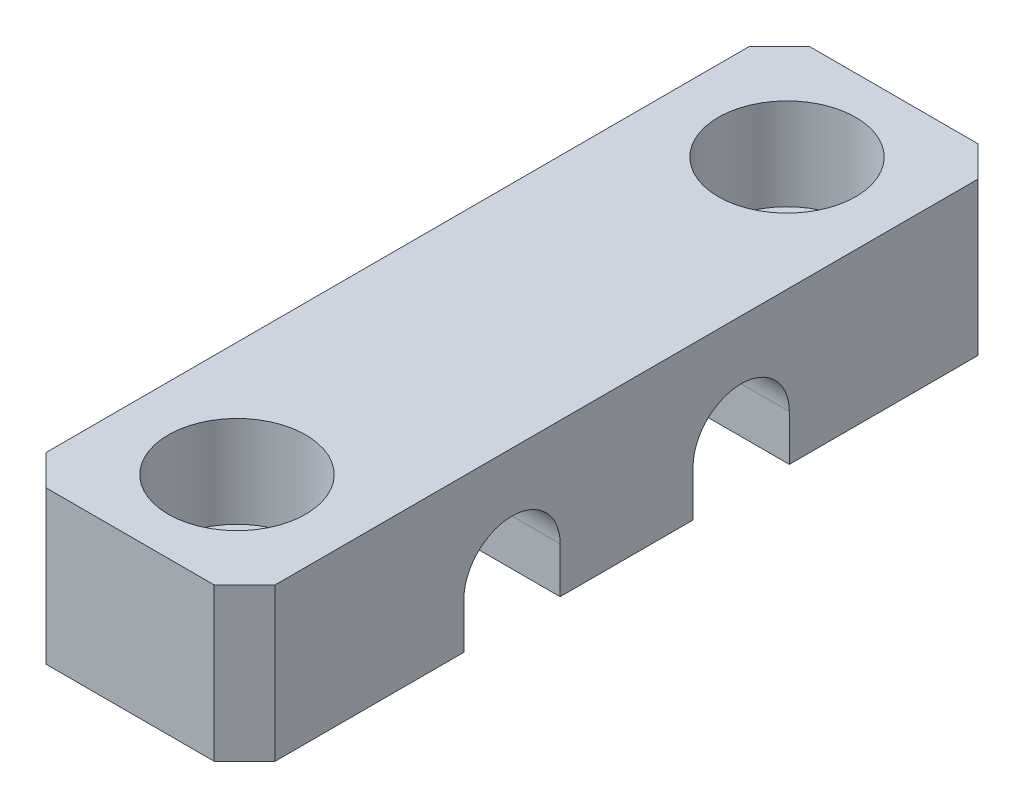
from build123d import *

# Parameters (mm, degrees)
SKETCH1_W           = 50
SKETCH1_H           = 10
BOSS_EXTRUDE1_DEPTH = 15
SKETCH3_R           = 4.5
CUT_EXTRUDE1_DEPTH  = 6
SKETCH4_R           = 3
CUT_EXTRUDE2_DEPTH  = 6
CUT_EXTRUDE3_DEPTH  = 30.580398915
CHAMFER1_SIZE       = 2


with BuildPart() as part:
    # Sketch1 → Boss-Extrude1 (new body)
    with BuildSketch(Plane(origin=(0, 0, 0), x_dir=(0, 0, -1), z_dir=(1, 0, 0))):
        Rectangle(SKETCH1_W, SKETCH1_H)
    extrude(amount=BOSS_EXTRUDE1_DEPTH)

    # Sketch3 → Cut-Extrude1 (cut)
    with BuildSketch(Plane(origin=(0, 5, 0), x_dir=(1, 0, 0), z_dir=(0, 1, 0))):
        with Locations(Location((7.5, -18, 0), (0, 0, 270))):
            Circle(SKETCH3_R)
        with Locations(Location((7.5, 18, 0), (0, 0, 270))):
            Circle(SKETCH3_R)
    extrude(amount=-CUT_EXTRUDE1_DEPTH, mode=Mode.SUBTRACT)

    # Sketch4 → Cut-Extrude2 (cut)
    with BuildSketch(Plane(origin=(0, -1, 0), x_dir=(1, 0, 0), z_dir=(0, 1, 0))):
        with Locations(Location((7.5, 18, 0), (0, 0, 270))):
            Circle(SKETCH4_R)
        with Locations(Location((7.5, -18, 0), (0, 0, 270))):
            Circle(SKETCH4_R)
    extrude(amount=-CUT_EXTRUDE2_DEPTH, mode=Mode.SUBTRACT)

    # Sketch5 → Cut-Extrude3 (cut, through all)
    with BuildSketch(Plane(origin=(15, 0, 0), x_dir=(0, 0, -1), z_dir=(1, 0, 0))):
        with BuildLine():
            Line((-4.35, -2), (-10.65, -2))
            ThreePointArc((-10.65, -2), (-10.04440329, -3.857016936), (-8.460468636, -5))
            Line((-8.460468636, -5), (-6.539531364, -5))
            ThreePointArc((-6.539531364, -5), (-4.95559671, -3.857016936), (-4.35, -2))
        make_face()
        with BuildLine():
            ThreePointArc((-4.35, -2), (-7.5, 1.15), (-10.65, -2))
            Line((-10.65, -2), (-4.35, -2))
        make_face()
        with BuildLine():
            Line((-8.460468636, -5), (-10.65, -5))
            Line((-10.65, -5), (-10.65, -9.185427258))
            Line((-10.65, -9.185427258), (-4.35, -9.185427258))
            Line((-4.35, -9.185427258), (-4.35, -5))
            Line((-4.35, -5), (-6.539531364, -5))
            ThreePointArc((-6.539531364, -5), (-7.5, -5.15), (-8.460468636, -5))
        make_face()
        with BuildLine():
            ThreePointArc((-8.460468636, -5), (-10.04440329, -3.857016936), (-10.65, -2))
            Line((-10.65, -2), (-10.65, -5))
            Line((-10.65, -5), (-8.460468636, -5))
        make_face()
        with BuildLine():
            Line((-4.35, -5), (-4.35, -2))
            ThreePointArc((-4.35, -2), (-4.95559671, -3.857016936), (-6.539531364, -5))
            Line((-6.539531364, -5), (-4.35, -5))
        make_face()
        with BuildLine():
            Line((4.35, -2), (4.35, -5))
            Line((4.35, -5), (6.539531364, -5))
            ThreePointArc((6.539531364, -5), (4.95559671, -3.857016936), (4.35, -2))
        make_face()
        with BuildLine():
            Line((10.65, -2), (4.35, -2))
            ThreePointArc((4.35, -2), (4.95559671, -3.857016936), (6.539531364, -5))
            Line((6.539531364, -5), (8.460468636, -5))
            ThreePointArc((8.460468636, -5), (10.04440329, -3.857016936), (10.65, -2))
        make_face()
        with BuildLine():
            ThreePointArc((10.65, -2), (7.5, 1.15), (4.35, -2))
            Line((4.35, -2), (10.65, -2))
        make_face()
        with BuildLine():
            Line((10.65, -5), (10.65, -2))
            ThreePointArc((10.65, -2), (10.04440329, -3.857016936), (8.460468636, -5))
            Line((8.460468636, -5), (10.65, -5))
        make_face()
    extrude(amount=-CUT_EXTRUDE3_DEPTH, mode=Mode.SUBTRACT)

    # Chamfer1
    chamfer1_edges = [part.edges().sort_by_distance(p)[0] for p in [
        (15, 0, 25),
        (15, 0, -25),
        (0, 0, 25),
        (0, 0, -25),
    ]]
    chamfer(chamfer1_edges, length=CHAMFER1_SIZE)


solid = part.part
